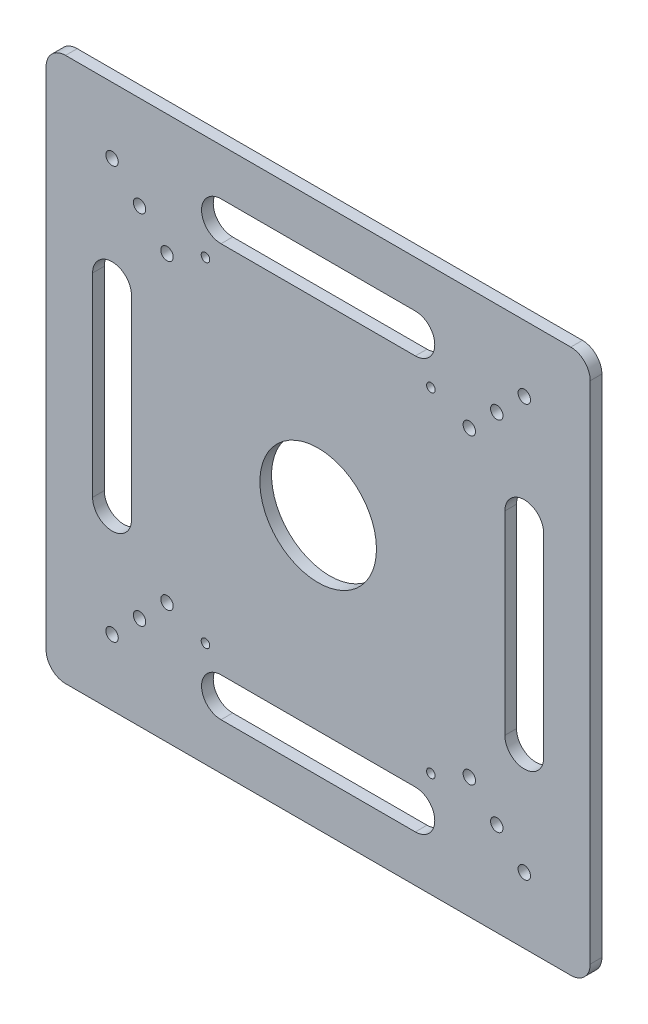
from build123d import *

# Parameters (mm, degrees)
SKETCH_1_W      = 140
SKETCH_1_H      = 140
SKETCH_1_R      = 1.6
SKETCH_1_R_2    = 1.1
SKETCH_1_R_3    = 15
EXTRUDE_1_DEPTH = 3
FILLET_1_R      = 5


with BuildPart() as part:
    # 草图1 → 凸台-拉伸1 (new body)
    with BuildSketch(Plane.XY):
        Rectangle(SKETCH_1_W, SKETCH_1_H)
        with Locations((53.033008589, 53.033008589)):
            Circle(SKETCH_1_R, mode=Mode.SUBTRACT)
        with Locations((-29, 43)):
            Circle(SKETCH_1_R_2, mode=Mode.SUBTRACT)
        with Locations((29, 43)):
            Circle(SKETCH_1_R_2, mode=Mode.SUBTRACT)
        with Locations(Location((29, -43, 0), (0, 0, 180))):
            Circle(SKETCH_1_R_2, mode=Mode.SUBTRACT)
        with Locations(Location((-29, -43, 0), (0, 0, 180))):
            Circle(SKETCH_1_R_2, mode=Mode.SUBTRACT)
        with Locations((53.033008589, -53.033008589)):
            Circle(SKETCH_1_R, mode=Mode.SUBTRACT)
        with Locations((-53.033008589, -53.033008589)):
            Circle(SKETCH_1_R, mode=Mode.SUBTRACT)
        with Locations((-53.033008589, 53.033008589)):
            Circle(SKETCH_1_R, mode=Mode.SUBTRACT)
        with Locations((45.961940777, 45.961940777)):
            Circle(SKETCH_1_R, mode=Mode.SUBTRACT)
        with Locations((38.890872965, 38.890872965)):
            Circle(SKETCH_1_R, mode=Mode.SUBTRACT)
        with Locations((45.961940777, -45.961940777)):
            Circle(SKETCH_1_R, mode=Mode.SUBTRACT)
        with Locations((38.890872965, -38.890872965)):
            Circle(SKETCH_1_R, mode=Mode.SUBTRACT)
        with Locations((-45.961940777, -45.961940777)):
            Circle(SKETCH_1_R, mode=Mode.SUBTRACT)
        with Locations((-38.890872965, -38.890872965)):
            Circle(SKETCH_1_R, mode=Mode.SUBTRACT)
        with Locations((-45.961940777, 45.961940777)):
            Circle(SKETCH_1_R, mode=Mode.SUBTRACT)
        with Locations((-38.890872965, 38.890872965)):
            Circle(SKETCH_1_R, mode=Mode.SUBTRACT)
        Circle(SKETCH_1_R_3, mode=Mode.SUBTRACT)
        with BuildLine():
            Line((-25, 58.033008589), (25, 58.033008589))
            ThreePointArc((25, 58.033008589), (30, 53.033008589), (25, 48.033008589))
            Line((25, 48.033008589), (-25, 48.033008589))
            ThreePointArc((-25, 48.033008589), (-30, 53.033008589), (-25, 58.033008589))
        make_face(mode=Mode.SUBTRACT)
        with BuildLine():
            Line((58.033008589, 25), (58.033008589, -25))
            ThreePointArc((58.033008589, -25), (53.033008589, -30), (48.033008589, -25))
            Line((48.033008589, -25), (48.033008589, 25))
            ThreePointArc((48.033008589, 25), (53.033008589, 30), (58.033008589, 25))
        make_face(mode=Mode.SUBTRACT)
        with BuildLine():
            Line((25, -58.033008589), (-25, -58.033008589))
            ThreePointArc((-25, -58.033008589), (-30, -53.033008589), (-25, -48.033008589))
            Line((-25, -48.033008589), (25, -48.033008589))
            ThreePointArc((25, -48.033008589), (30, -53.033008589), (25, -58.033008589))
        make_face(mode=Mode.SUBTRACT)
        with BuildLine():
            Line((-58.033008589, -25), (-58.033008589, 25))
            ThreePointArc((-58.033008589, 25), (-53.033008589, 30), (-48.033008589, 25))
            Line((-48.033008589, 25), (-48.033008589, -25))
            ThreePointArc((-48.033008589, -25), (-53.033008589, -30), (-58.033008589, -25))
        make_face(mode=Mode.SUBTRACT)
    extrude(amount=EXTRUDE_1_DEPTH)

    # 圆角1
    fillet_1_edges = [part.edges().sort_by_distance(p)[0] for p in [
        (-70, 70, 1.5),
        (70, 70, 1.5),
        (70, -70, 1.5),
        (-70, -70, 1.5),
    ]]
    fillet(fillet_1_edges, radius=FILLET_1_R)


solid = part.part
